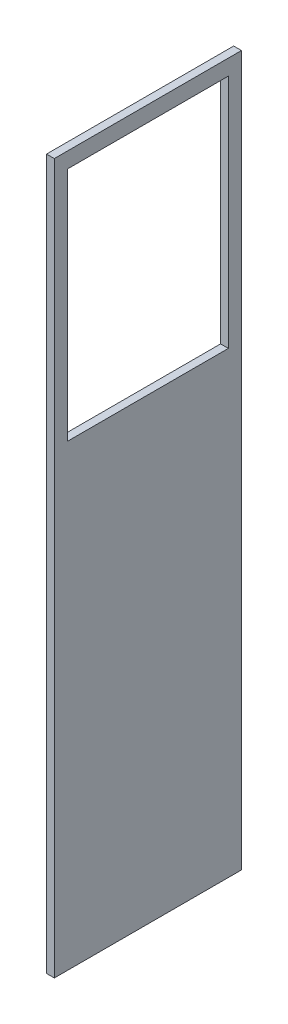
from build123d import *

# Parameters (mm, degrees)
SKETCH1_W           = 76.2
SKETCH1_H           = 288.925
BOSS_EXTRUDE1_DEPTH = 3.175
CUT_EXTRUDE1_REACH  = 300.821
SKETCH2_W           = 65.532
SKETCH2_H           = 96.012


with BuildPart() as part:
    # Sketch1 → Boss-Extrude1 (new body)
    with BuildSketch(Plane(origin=(0, 0, 0), x_dir=(0, 0, -1), z_dir=(1, 0, 0))):
        with Locations((38.1, 144.4625)):
            Rectangle(SKETCH1_W, SKETCH1_H)
    extrude(amount=BOSS_EXTRUDE1_DEPTH)

    # Sketch2 → Cut-Extrude1 (cut, up to next)
    with BuildSketch(Plane.ZY, mode=Mode.PRIVATE) as cut_extrude1_sk1:
        with Locations((-38.1, 234.569)):
            Rectangle(SKETCH2_W, SKETCH2_H)
    cut_extrude1_tool1 = extrude(cut_extrude1_sk1.sketch, amount=-CUT_EXTRUDE1_REACH, mode=Mode.PRIVATE) & part.part
    add(cut_extrude1_tool1.solids().sort_by_distance((0, 234.569, -38.1))[0], mode=Mode.SUBTRACT)


solid = part.part
